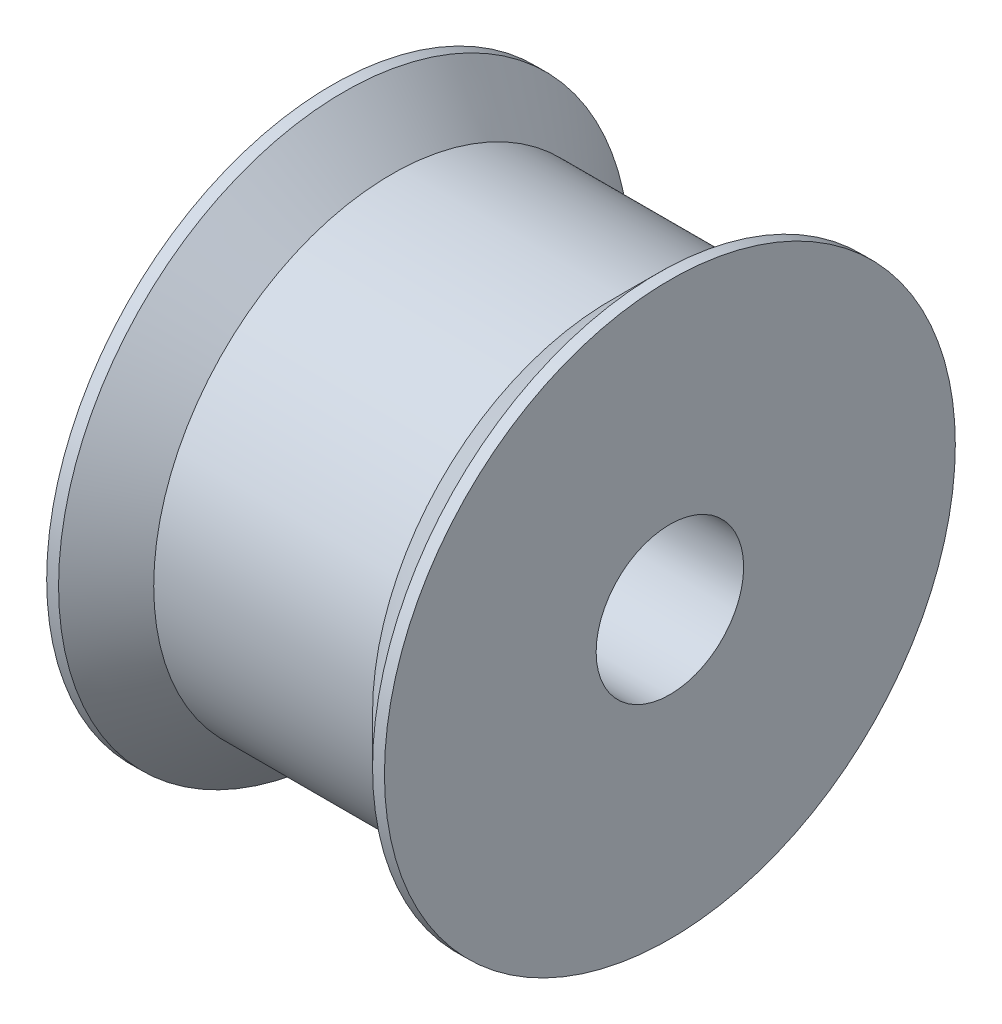
from build123d import *

# Parameters (mm, degrees)
SKETCH3_R          = 3.1
CUT_EXTRUDE1_DEPTH = 14.2


with BuildPart() as part:
    # Sketch2 → Revolve1 (revolve)
    with BuildSketch(Plane(origin=(0, 0, 0), x_dir=(1, 0, 0), z_dir=(0, 1, 0))):
        Polygon((-7.1, 12), (-6.6, 12), (-4.6, 10), (4.6, 10), (6.6, 12), (7.1, 12), (7.1, 0), (-7.1, 0), align=None)
    revolve(axis=Axis((7.1, 0, 0), (-1, 0, 0)))

    # Sketch3 → Cut-Extrude1 (cut)
    with BuildSketch(Plane.ZY.offset(7.1)):
        Circle(SKETCH3_R)
    extrude(amount=-CUT_EXTRUDE1_DEPTH, mode=Mode.SUBTRACT)


solid = part.part
